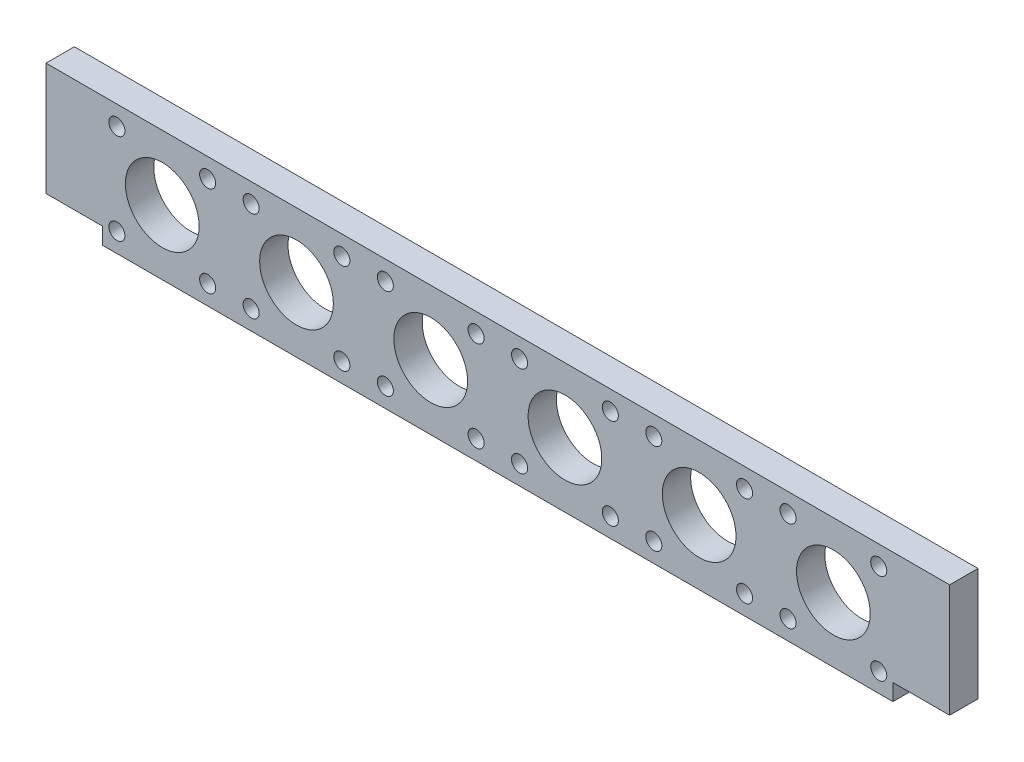
from build123d import *

# Parameters (mm, degrees)
ESQUISSE1_W                  = 478
ESQUISSE1_H                  = 68.5
BOSS_EXTRU_1_DEPTH           = 15
ENL_V_MAT_EXTRU_1_DEPTH      = 484.116186854
ENL_V_MAT_EXTRU_1_DEPTH_BACK = 484.116186854
ESQUISSE2_R                  = 4.25
ENL_V_MAT_EXTRU_2_DEPTH      = 484.116186854
ENL_V_MAT_EXTRU_2_DEPTH_BACK = 484.116186854
ESQUISSE3_R                  = 19.5
ENL_V_MAT_EXTRU_3_DEPTH      = 484.116186854
ENL_V_MAT_EXTRU_3_DEPTH_BACK = 484.116186854
ESQUISSE4_W                  = 30
ESQUISSE4_H                  = 8.75


with BuildPart() as part:
    # Esquisse1 → Boss.-Extru.1 (new body)
    with BuildSketch(Plane.XY):
        with Locations((239, 34.25)):
            Rectangle(ESQUISSE1_W, ESQUISSE1_H)
    extrude(amount=BOSS_EXTRU_1_DEPTH)

    # Esquisse2 → Enlèv. mat.-Extru.1 (cut, two sides: drawn at the far end of the back side and taken through both)
    with BuildSketch(Plane.XY.offset(15).offset(-ENL_V_MAT_EXTRU_1_DEPTH_BACK)):
        with Locations((227.5, 58.25)):
            Circle(ESQUISSE2_R)
        with Locations(Location((227.5, 10.25, 0), (0, 0, 180))):
            Circle(ESQUISSE2_R)
        with Locations((179.5, 10.25)):
            Circle(ESQUISSE2_R)
        with Locations(Location((179.5, 58.25, 0), (0, 0, 180))):
            Circle(ESQUISSE2_R)
        with Locations((156.5, 58.25)):
            Circle(ESQUISSE2_R)
        with Locations(Location((156.5, 10.25, 0), (0, 0, 180))):
            Circle(ESQUISSE2_R)
        with Locations((108.5, 10.25)):
            Circle(ESQUISSE2_R)
        with Locations(Location((108.5, 58.25, 0), (0, 0, 180))):
            Circle(ESQUISSE2_R)
        with Locations((85.5, 58.25)):
            Circle(ESQUISSE2_R)
        with Locations(Location((85.5, 10.25, 0), (0, 0, 180))):
            Circle(ESQUISSE2_R)
        with Locations((37.5, 10.25)):
            Circle(ESQUISSE2_R)
        with Locations(Location((37.5, 58.25, 0), (0, 0, 180))):
            Circle(ESQUISSE2_R)
        with Locations((440.5, 58.25)):
            Circle(ESQUISSE2_R)
        with Locations(Location((440.5, 10.25, 0), (0, 0, 180))):
            Circle(ESQUISSE2_R)
        with Locations((392.5, 10.25)):
            Circle(ESQUISSE2_R)
        with Locations(Location((392.5, 58.25, 0), (0, 0, 180))):
            Circle(ESQUISSE2_R)
        with Locations((369.5, 58.25)):
            Circle(ESQUISSE2_R)
        with Locations(Location((369.5, 10.25, 0), (0, 0, 180))):
            Circle(ESQUISSE2_R)
        with Locations((321.5, 10.25)):
            Circle(ESQUISSE2_R)
        with Locations(Location((321.5, 58.25, 0), (0, 0, 180))):
            Circle(ESQUISSE2_R)
        with Locations((298.5, 58.25)):
            Circle(ESQUISSE2_R)
        with Locations(Location((298.5, 10.25, 0), (0, 0, 180))):
            Circle(ESQUISSE2_R)
        with Locations((250.5, 10.25)):
            Circle(ESQUISSE2_R)
        with Locations(Location((250.5, 58.25, 0), (0, 0, 180))):
            Circle(ESQUISSE2_R)
    extrude(amount=ENL_V_MAT_EXTRU_1_DEPTH + ENL_V_MAT_EXTRU_1_DEPTH_BACK, mode=Mode.SUBTRACT)

    # Esquisse3 → Enlèv. mat.-Extru.2 (cut, two sides: drawn at the far end of the back side and taken through both)
    with BuildSketch(Plane.XY.offset(15).offset(-ENL_V_MAT_EXTRU_2_DEPTH_BACK)):
        with Locations((203.5, 34.25)):
            Circle(ESQUISSE3_R)
        with Locations((132.5, 34.25)):
            Circle(ESQUISSE3_R)
        with Locations((61.5, 34.25)):
            Circle(ESQUISSE3_R)
        with Locations(Location((416.5, 34.25, 0), (0, 0, 180))):
            Circle(ESQUISSE3_R)
        with Locations(Location((345.5, 34.25, 0), (0, 0, 180))):
            Circle(ESQUISSE3_R)
        with Locations(Location((274.5, 34.25, 0), (0, 0, 180))):
            Circle(ESQUISSE3_R)
    extrude(amount=ENL_V_MAT_EXTRU_2_DEPTH + ENL_V_MAT_EXTRU_2_DEPTH_BACK, mode=Mode.SUBTRACT)

    # Esquisse4 → Enlèv. mat.-Extru.3 (cut, two sides: drawn at the far end of the back side and taken through both)
    with BuildSketch(Plane.XY.offset(15).offset(-ENL_V_MAT_EXTRU_3_DEPTH_BACK)):
        with Locations((15, 4.375)):
            Rectangle(ESQUISSE4_W, ESQUISSE4_H)
        with Locations((463, 4.375)):
            Rectangle(ESQUISSE4_W, ESQUISSE4_H)
    extrude(amount=ENL_V_MAT_EXTRU_3_DEPTH + ENL_V_MAT_EXTRU_3_DEPTH_BACK, mode=Mode.SUBTRACT)


solid = part.part
